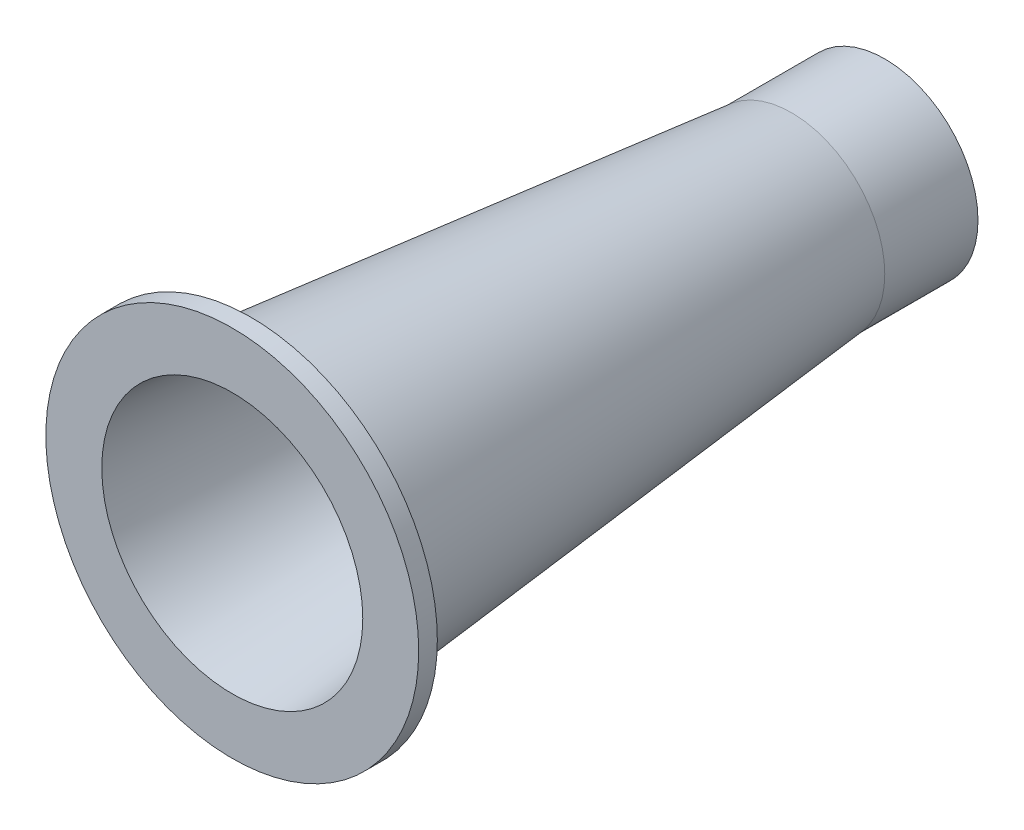
from build123d import *

# Parameters (mm, degrees)
SKETCH2_R          = 3
CUT_EXTRUDE1_DEPTH = 755.983443527


with BuildPart() as part:
    # Sketch1 → Revolve1 (revolve)
    with BuildSketch(Plane(origin=(0, 0, 0), x_dir=(1, 0, 0), z_dir=(0, 1, 0))):
        with BuildLine():
            Line((60, 700), (100, 700))
            Line((100, 700), (100, 600))
            Line((100, 600), (158.096747357, 20))
            Line((158.096747357, 20), (200, 20))
            Line((200, 20), (200, 0))
            Line((200, 0), (140, 0))
            Line((140, 0), (80.361922702, 595.387631955))
            ThreePointArc((80.361922702, 595.387631955), (78.741539447, 598.596831406), (75.386818985, 599.889291707))
            Line((75.386818985, 599.889291707), (60, 599.889291707))
            Line((60, 599.889291707), (60, 700))
        make_face()
    revolve(axis=Axis((0, 0, 396.040868455), (0, 0, -1)))

    # Sketch2 → Cut-Extrude1 (cut, through all)
    with BuildSketch(Plane(origin=(0, 0, 0), x_dir=(1, 0, 0), z_dir=(0, 1, 0))):
        with Locations(Location((0, 660, 0), (0, 0, 270))):
            Circle(SKETCH2_R)
    extrude(amount=-CUT_EXTRUDE1_DEPTH, mode=Mode.SUBTRACT)


solid = part.part
